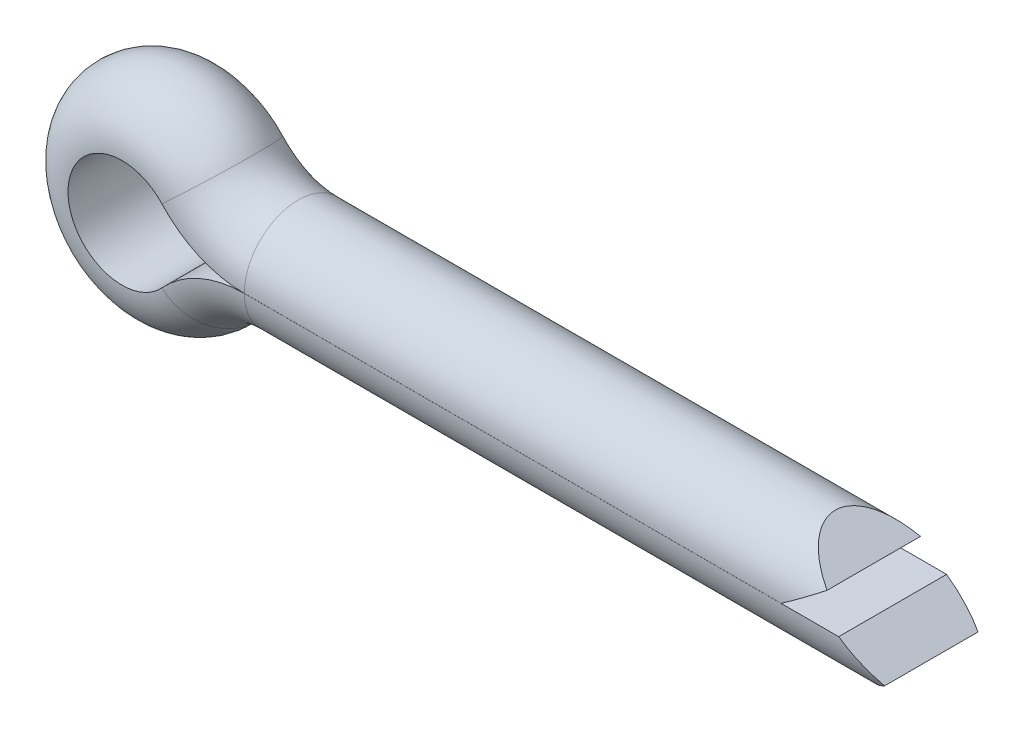
from build123d import *

# Parameters (mm, degrees)
CONECUT_DEPTH      = 45.791879825
CONECUT_DEPTH_BACK = 45.791879825


with BuildPart() as part:
    # Body: sweep along a path in PathSke
    with BuildLine(Plane.XY) as body_path:
        Line((40, 3.75), (0, 3.75))
        ThreePointArc((0, 3.75), (-1.617924495, 4.091037812), (-2.960535844, 5.056118755))
        ThreePointArc((-2.960535844, 5.056118755), (-16, 0), (-2.960535844, -5.056118755))
        ThreePointArc((-2.960535844, -5.056118755), (-1.617924495, -4.091037812), (0, -3.75))
        Line((0, -3.75), (44, -3.75))
    # SectionSke → Body (sweep)
    with BuildSketch(Plane(origin=(40, 0, 0), x_dir=(0, 0, -1), z_dir=(1, 0, 0))):
        with BuildLine():
            Line((-3.749999467, 0.002), (3.749999467, 0.002))
            ThreePointArc((3.749999467, 0.002), (0, 3.75), (-3.749999467, 0.002))
        make_face()
    sweep(path=body_path.line)

    # ConeCutSke → ConeCut (cut, two sides: drawn at the far end of the back side and taken through both)
    with BuildSketch(Plane.XY.offset(-CONECUT_DEPTH_BACK)):
        Polygon((40, 1.876), (37.317882577, 3.76), (44.01, 3.76), (44.01, -3.76), (41.317882577, -3.76), (44, -1.876), (41.312280917, 0), (37.312280917, 0), align=None)
    extrude(amount=CONECUT_DEPTH + CONECUT_DEPTH_BACK, mode=Mode.SUBTRACT)


solid = part.part
